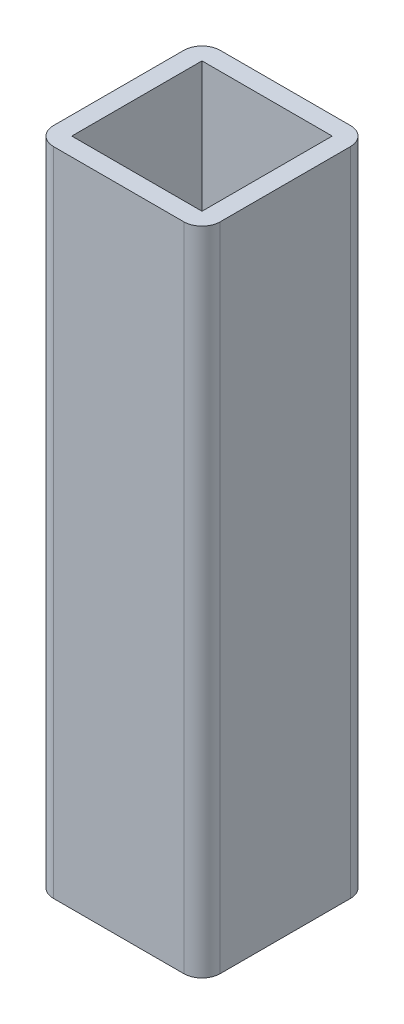
from build123d import *

# Parameters (mm, degrees)
BOSS_EXTRUDE1_DEPTH = 100
SKETCH3_W           = 20
SKETCH3_H           = 20
CUT_EXTRUDE1_DEPTH  = 1040.5


with BuildPart() as part:
    # Sketch1 → Boss-Extrude1 (new body)
    with BuildSketch(Plane(origin=(0, 0, 0), x_dir=(1, 0, 0), z_dir=(0, 1, 0))):
        with BuildLine():
            Line((2.8, 0), (22.8, 0))
            ThreePointArc((22.8, 0), (24.779898987, -0.820101013), (25.6, -2.8))
            Line((25.6, -2.8), (25.6, -22.8))
            ThreePointArc((25.6, -22.8), (24.779898987, -24.779898987), (22.8, -25.6))
            Line((22.8, -25.6), (2.8, -25.6))
            ThreePointArc((2.8, -25.6), (0.820101013, -24.779898987), (0, -22.8))
            Line((0, -22.8), (0, -2.8))
            ThreePointArc((0, -2.8), (0.820101013, -0.820101013), (2.8, 0))
        make_face()
    extrude(amount=BOSS_EXTRUDE1_DEPTH)

    # Sketch3 → Cut-Extrude1 (cut)
    with BuildSketch(Plane(origin=(0, 0, 0), x_dir=(-1, 0, 0), z_dir=(0, -1, 0))):
        with Locations((-12.8, -12.8)):
            Rectangle(SKETCH3_W, SKETCH3_H)
    extrude(amount=-CUT_EXTRUDE1_DEPTH, mode=Mode.SUBTRACT)


solid = part.part
